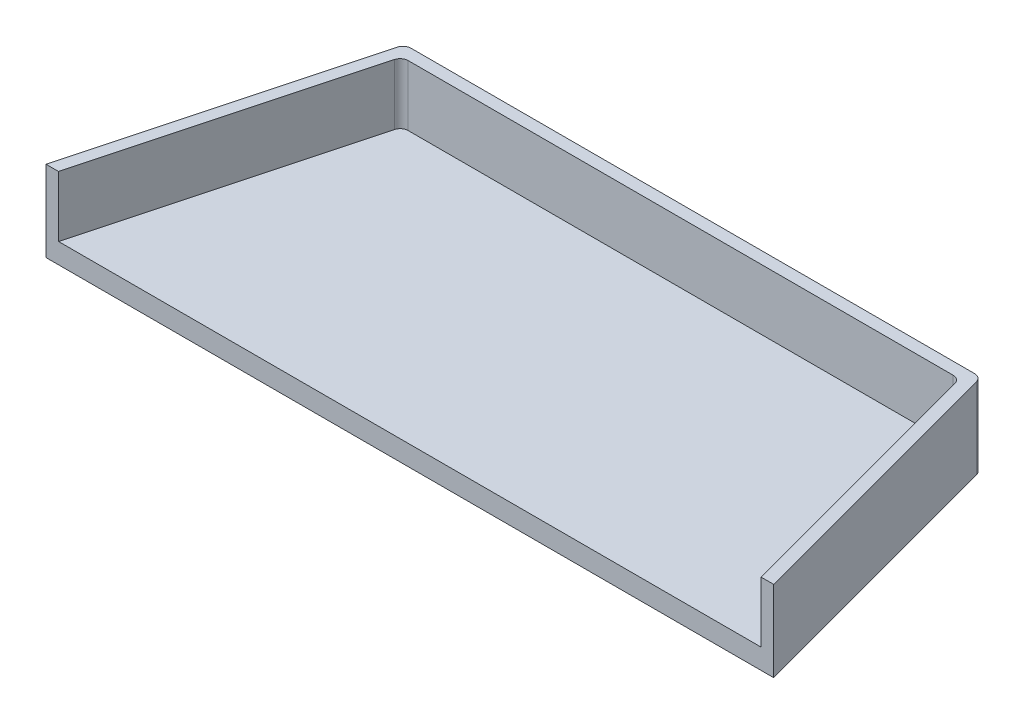
from build123d import *

# Parameters (mm, degrees)
BOSS_EXTRUDE1_DEPTH = 5
BOSS_EXTRUDE2_DEPTH = 15
FILLET1_R           = 2


with BuildPart() as part:
    # Sketch1 → Boss-Extrude1 (new body)
    with BuildSketch(Plane(origin=(0, 0, 0), x_dir=(1, 0, 0), z_dir=(0, 1, 0))):
        Polygon((71.24355653, 70), (-71.24355653, 70), (-90, 0), (90, 0), align=None)
    extrude(amount=BOSS_EXTRUDE1_DEPTH)

    # Sketch2 → Boss-Extrude2 (add)
    with BuildSketch(Plane(origin=(0, 5, 0), x_dir=(1, 0, 0), z_dir=(0, 1, 0))):
        Polygon((68.941575566, 67), (-68.941575566, 67), (-86.894171459, 0), (-90, 0), (-71.24355653, 70), (71.24355653, 70), (90, 0), (86.894171459, 0), align=None)
    extrude(amount=BOSS_EXTRUDE2_DEPTH)

    # Fillet1
    fillet1_edges = [part.edges().sort_by_distance(p)[0] for p in [
        (-68.941575566, 12.5, -67),
        (68.941575566, 12.5, -67),
        (-71.24355653, 10, -70),
        (71.24355653, 10, -70),
    ]]
    fillet(fillet1_edges, radius=FILLET1_R)


solid = part.part
